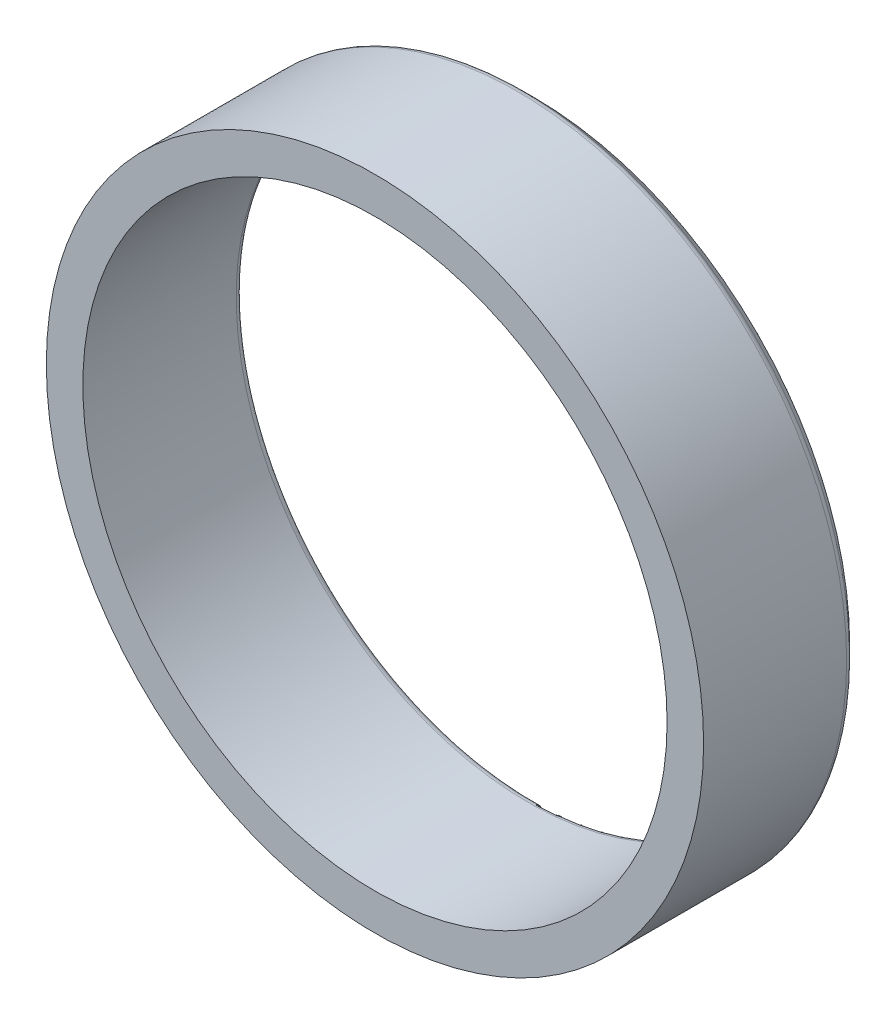
from build123d import *

# Parameters (mm, degrees)
SKETCH1_R           = 45
SKETCH1_R_2         = 40
BOSS_EXTRUDE1_DEPTH = 22
CHAMFER1_SIZE       = 2
FILLET1_R           = 1


with BuildPart() as part:
    # Sketch1 → Boss-Extrude1 (new body)
    with BuildSketch(Plane.XY):
        Circle(SKETCH1_R)
        Circle(SKETCH1_R_2, mode=Mode.SUBTRACT)
    extrude(amount=BOSS_EXTRUDE1_DEPTH)

    # Chamfer1
    chamfer1_edges = [part.edges().sort_by_distance(p)[0] for p in [
        (-45, 0, 0),
    ]]
    chamfer(chamfer1_edges, length=CHAMFER1_SIZE)

    # Fillet1
    fillet1_edges = [part.edges().sort_by_distance(p)[0] for p in [
        (-45, 0, 2),
        (-43, 0, 0),
        (-40, 0, 0),
    ]]
    fillet(fillet1_edges, radius=FILLET1_R)


solid = part.part
